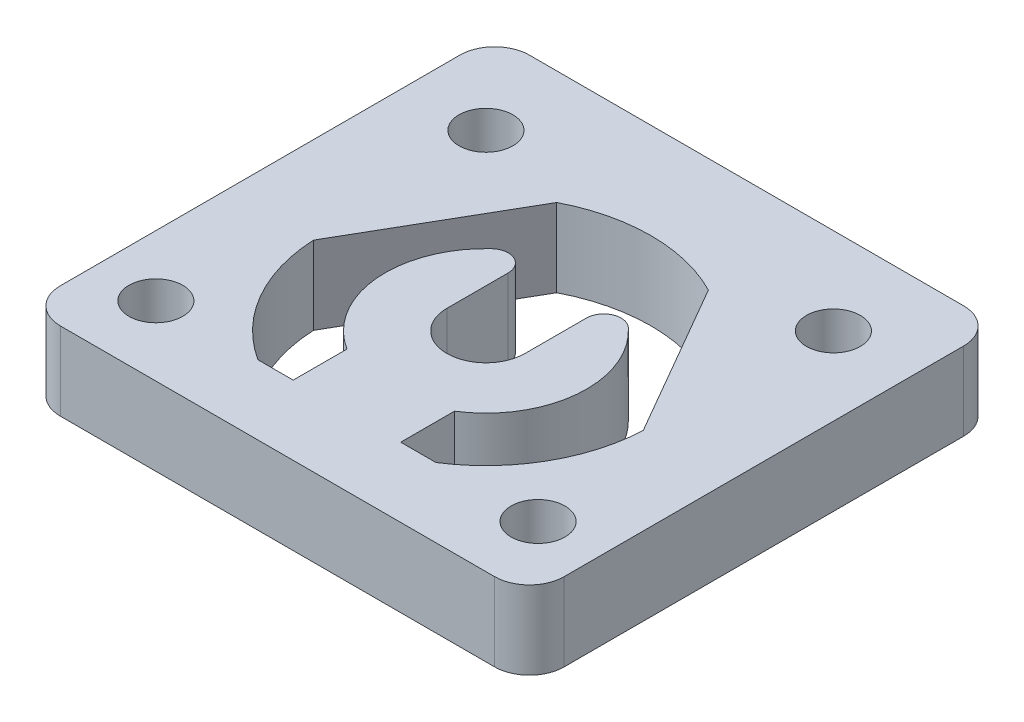
from build123d import *

# Parameters (mm, degrees)
SKETCH3_R           = 1.55
BOSS_EXTRUDE1_DEPTH = 4.5


with BuildPart() as part:
    # Sketch3 → Boss-Extrude1 (new body)
    with BuildSketch(Plane(origin=(0, 0, 0), x_dir=(1, 0, 0), z_dir=(0, 1, 0))):
        with BuildLine():
            Line((-14.5, -10), (-14.5, 13))
            ThreePointArc((-14.5, 13), (-13.914213562, 14.414213562), (-12.5, 15))
            Line((-12.5, 15), (12.5, 15))
            ThreePointArc((12.5, 15), (13.914213562, 14.414213562), (14.5, 13))
            Line((14.5, 13), (14.5, -10))
            ThreePointArc((14.5, -10), (13.914213562, -11.414213562), (12.5, -12))
            Line((12.5, -12), (-12.5, -12))
            ThreePointArc((-12.5, -12), (-13.914213562, -11.414213562), (-14.5, -10))
        make_face()
        with Locations(Location((10, 10, 0), (0, 0, 270))):
            Circle(SKETCH3_R, mode=Mode.SUBTRACT)
        with Locations(Location((11, -8, 0), (0, 0, 270))):
            Circle(SKETCH3_R, mode=Mode.SUBTRACT)
        with Locations(Location((-11, -8, 0), (0, 0, 90))):
            Circle(SKETCH3_R, mode=Mode.SUBTRACT)
        with Locations(Location((-10, 10, 0), (0, 0, 90))):
            Circle(SKETCH3_R, mode=Mode.SUBTRACT)
        with BuildLine():
            Line((3.094753625, -4.905354218), (3.094753625, -8))
            Line((3.094753625, -8), (5.123475383, -8))
            ThreePointArc((5.123475383, -8), (8.227241336, -4.75), (9.489940922, -0.437059837))
            Line((9.489940922, -0.437059837), (4.366465539, 8.437059837))
            ThreePointArc((4.366465539, 8.437059837), (0, 9.5), (-4.366465539, 8.437059837))
            Line((-4.366465539, 8.437059837), (-9.489940922, -0.437059837))
            ThreePointArc((-9.489940922, -0.437059837), (-8.227241336, -4.75), (-5.123475383, -8))
            Line((-5.123475383, -8), (-3.094753625, -8))
            Line((-3.094753625, -8), (-3.094753625, -4.905354218))
            ThreePointArc((-3.094753625, -4.905354218), (-5.776273327, -0.524086301), (-3.927083333, 4.268256845))
            ThreePointArc((-3.927083333, 4.268256845), (-2.848181218, 4.4480697), (-2.25, 3.532350492))
            Line((-2.25, 3.532350492), (-2.25, 0))
            ThreePointArc((-2.25, 0), (0, -2.25), (2.25, 0))
            Line((2.25, 0), (2.25, 3.532350492))
            ThreePointArc((2.25, 3.532350492), (2.848181218, 4.4480697), (3.927083333, 4.268256845))
            ThreePointArc((3.927083333, 4.268256845), (5.776273327, -0.524086301), (3.094753625, -4.905354218))
        make_face(mode=Mode.SUBTRACT)
    extrude(amount=BOSS_EXTRUDE1_DEPTH)


solid = part.part
